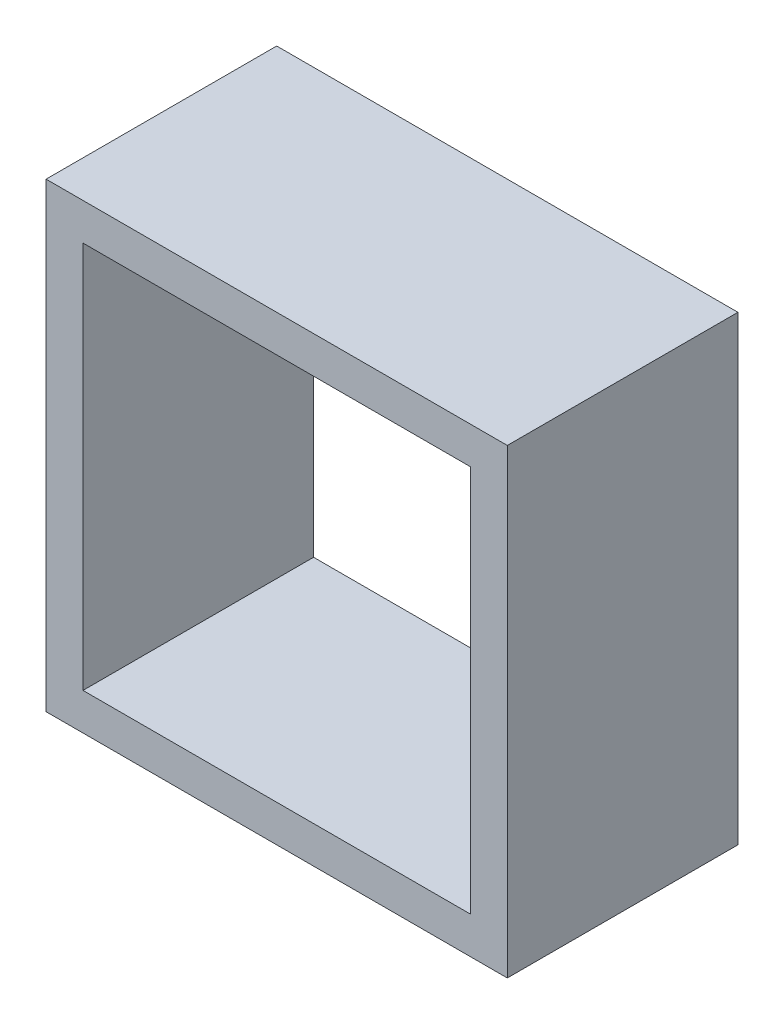
from build123d import *

# Parameters (mm, degrees)
ESQUISSE1_W        = 10
ESQUISSE1_H        = 10
ESQUISSE1_W_2      = 8.4
ESQUISSE1_H_2      = 8.4
BOSS_EXTRU_1_DEPTH = 5


with BuildPart() as part:
    # Esquisse1 → Boss.-Extru.1 (new body)
    with BuildSketch(Plane.XY):
        Rectangle(ESQUISSE1_W, ESQUISSE1_H)
        Rectangle(ESQUISSE1_W_2, ESQUISSE1_H_2, mode=Mode.SUBTRACT)
    extrude(amount=BOSS_EXTRU_1_DEPTH)


solid = part.part
